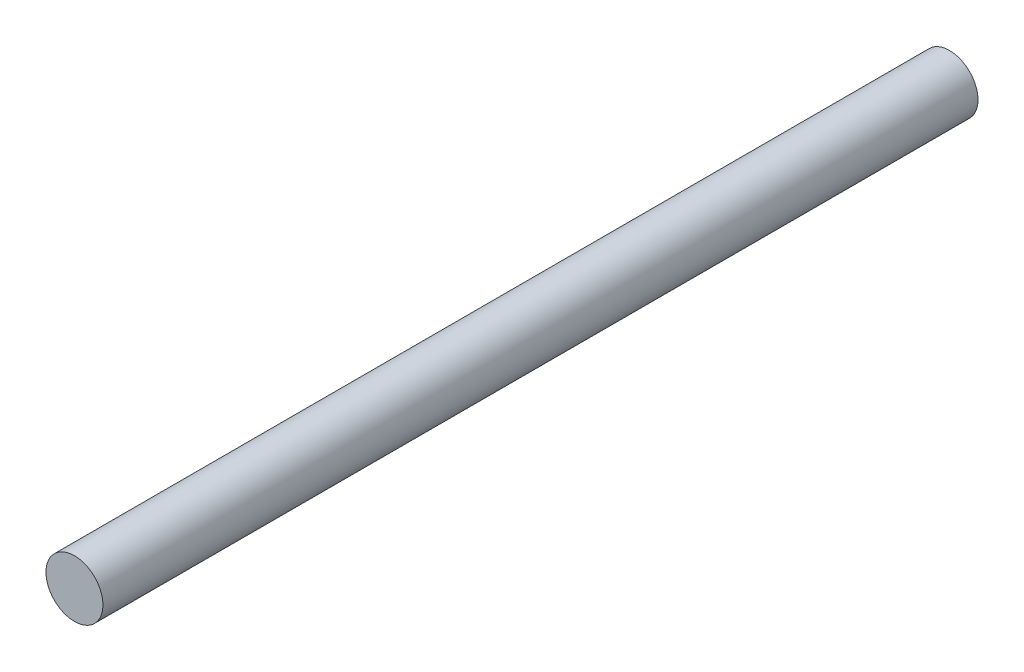
from build123d import *

# Parameters (mm, degrees)
SKETCH1_R           = 7
BOSS_EXTRUDE1_DEPTH = 215


with BuildPart() as part:
    # Sketch1 → Boss-Extrude1 (new body)
    with BuildSketch(Plane.XY):
        Circle(SKETCH1_R)
    extrude(amount=BOSS_EXTRUDE1_DEPTH)


solid = part.part
